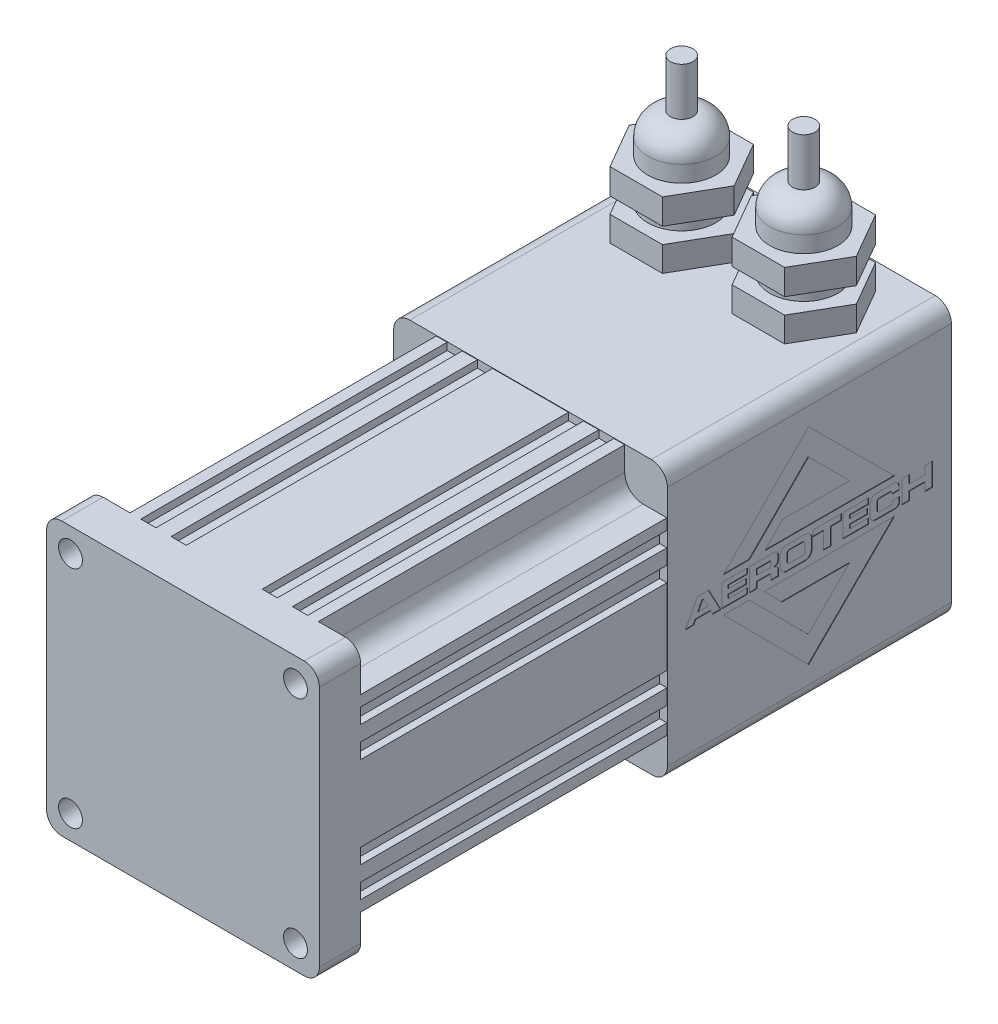
from build123d import *

# Parameters (mm, degrees)
SKETCH1_R                = 2.5
FRONT_MOUNT_PLATE_DEPTH  = 8.64
MOTOR_START              = 64.18
MOTOR_DEPTH              = 64.18
SKETCH3_W                = 3.175
SKETCH3_H                = 1.524
MOTOR_FINS_DEPTH         = 76.842822007
MOTOR_FINS_PATTERN_COUNT = 4
MOTOR_FINS_PATTERN_ANGLE = 270
ENC_CAN_DEPTH            = 59.51
LOGO_1_DEPTH             = 0.1
LOGO_2_DEPTH             = 0.1
SKETCH6_R                = 7.1247
EXTRUDE4_DEPTH           = 5.33
MIRROR3_COPY_1_SKETCH_R  = 7.1247
MIRROR3_COPY_1_DEPTH     = 5.33


with BuildPart() as part:
    # Sketch1 → Front Mount Plate (new body)
    with BuildSketch(Plane.XY):
        with BuildLine():
            Line((-25.4, 28.575), (25.4, 28.575))
            ThreePointArc((25.4, 28.575), (27.64506403, 27.64506403), (28.575, 25.4))
            Line((28.575, 25.4), (28.575, -25.4))
            ThreePointArc((28.575, -25.4), (27.64506403, -27.64506403), (25.4, -28.575))
            Line((25.4, -28.575), (-25.4, -28.575))
            ThreePointArc((-25.4, -28.575), (-27.64506403, -27.64506403), (-28.575, -25.4))
            Line((-28.575, -25.4), (-28.575, 25.4))
            ThreePointArc((-28.575, 25.4), (-27.64506403, 27.64506403), (-25.4, 28.575))
        make_face()
        with Locations((-23.5712, -23.5712)):
            Circle(SKETCH1_R, mode=Mode.SUBTRACT)
        with Locations((23.5712, -23.5712)):
            Circle(SKETCH1_R, mode=Mode.SUBTRACT)
        with Locations((23.5712, 23.5712)):
            Circle(SKETCH1_R, mode=Mode.SUBTRACT)
        with Locations((-23.5712, 23.5712)):
            Circle(SKETCH1_R, mode=Mode.SUBTRACT)
    extrude(amount=FRONT_MOUNT_PLATE_DEPTH)

    # Sketch2 → Motor (add)
    with BuildSketch(Plane(origin=(0, 0, 0), x_dir=(-1, 0, 0), z_dir=(0, 0, -1)).offset(MOTOR_START)):
        with BuildLine():
            Line((-28.575, -25.4), (-28.575, 25.4))
            ThreePointArc((-28.575, 25.4), (-27.64506403, 27.64506403), (-25.4, 28.575))
            Line((-25.4, 28.575), (25.4, 28.575))
            ThreePointArc((25.4, 28.575), (27.64506403, 27.64506403), (28.575, 25.4))
            Line((28.575, 25.4), (28.575, -25.4))
            ThreePointArc((28.575, -25.4), (27.64506403, -27.64506403), (25.4, -28.575))
            Line((25.4, -28.575), (-25.4, -28.575))
            ThreePointArc((-25.4, -28.575), (-27.64506403, -27.64506403), (-28.575, -25.4))
        make_face()
    extrude(amount=-MOTOR_DEPTH)

    # Sketch3 → Motor Fins (cut, through all)
    with BuildSketch(Plane.XY):
        with Locations((15.8877, 27.813)):
            Rectangle(SKETCH3_W, SKETCH3_H)
        with Locations((9.5377, 27.813)):
            Rectangle(SKETCH3_W, SKETCH3_H)
        with Locations((-9.5377, 27.813)):
            Rectangle(SKETCH3_W, SKETCH3_H)
        with Locations((-15.8877, 27.813)):
            Rectangle(SKETCH3_W, SKETCH3_H)
        with BuildLine():
            Line((-25.4, 28.575), (-19.7358, 28.575))
            Line((-19.7358, 28.575), (-19.7358, 23.5712))
            ThreePointArc((-19.7358, 23.5712), (-20.859162651, 20.859162651), (-23.5712, 19.7358))
            Line((-23.5712, 19.7358), (-28.575, 19.7358))
            Line((-28.575, 19.7358), (-28.575, 25.4))
            ThreePointArc((-28.575, 25.4), (-27.64506403, 27.64506403), (-25.4, 28.575))
        make_face()
    motor_fins = extrude(amount=-MOTOR_FINS_DEPTH, mode=Mode.SUBTRACT)

    # Motor Fins Pattern: Motor Fins ×4 about axis
    motor_fins_pattern_axis = Axis((0, 0, 0), (0, 0, 1))
    for i in range(1, MOTOR_FINS_PATTERN_COUNT):
        add(motor_fins.rotate(motor_fins_pattern_axis, i * MOTOR_FINS_PATTERN_ANGLE / (MOTOR_FINS_PATTERN_COUNT - 1)), mode=Mode.SUBTRACT)

    # Sketch4 → Enc Can (add)
    with BuildSketch(Plane(origin=(0, 0, -64.18), x_dir=(-1, 0, 0), z_dir=(0, 0, -1))):
        with BuildLine():
            Line((-25.3, 28.675), (25.3, 28.675))
            ThreePointArc((25.3, 28.675), (27.686485387, 27.686485387), (28.675, 25.3))
            Line((28.675, 25.3), (28.675, -25.3))
            ThreePointArc((28.675, -25.3), (27.74506403, -27.54506403), (25.5, -28.475))
            Line((25.5, -28.475), (-25.5, -28.475))
            ThreePointArc((-25.5, -28.475), (-27.74506403, -27.54506403), (-28.675, -25.3))
            Line((-28.675, -25.3), (-28.675, 25.3))
            ThreePointArc((-28.675, 25.3), (-27.686485387, 27.686485387), (-25.3, 28.675))
        make_face()
    extrude(amount=ENC_CAN_DEPTH)

    # Sketch11 → Logo-1 (cut)
    # profile 1 of 10: a face of its own
    with BuildSketch(Plane(origin=(28.675, 0, 0), x_dir=(0, 0, -1), z_dir=(1, 0, 0))):
        with BuildLine():
            Line((88.956539472, 2.316788931), (93.122148965, 2.316788931))
            ThreePointArc((93.122148965, 2.316788931), (94.084778657, 1.918054657), (94.483512931, 0.955424964))
            Line((94.483512931, 0.955424964), (94.483512931, -1.038605321))
            ThreePointArc((94.483512931, -1.038605321), (94.072113232, -2.031812054), (93.078906499, -2.443211754))
            Line((93.078906499, -2.443211754), (89.26866391, -2.443211754))
            ThreePointArc((89.26866391, -2.443211754), (88.232093749, -2.013850335), (87.80273233, -0.977280174))
            Line((87.80273233, -0.977280174), (87.80273233, 0.955374767))
            ThreePointArc((87.80273233, 0.955374767), (88.129983456, 1.84766388), (88.956539472, 2.316788931))
        make_face()
        with BuildLine():
            Line((91.079448669, 1.16369414), (92.556319474, 1.16369414))
            ThreePointArc((92.556319474, 1.16369414), (92.868638989, 1.03432716), (92.998005968, 0.722007645))
            Line((92.998005968, 0.722007645), (92.998005968, -0.809664847))
            ThreePointArc((92.998005968, -0.809664847), (92.870330318, -1.117901134), (92.562094031, -1.245576785))
            Line((92.562094031, -1.245576785), (89.822537295, -1.245576785))
            ThreePointArc((89.822537295, -1.245576785), (89.487816379, -1.106930841), (89.349170436, -0.772209925))
            Line((89.349170436, -0.772209925), (89.349170436, 0.730051524))
            ThreePointArc((89.349170436, 0.730051524), (89.479434311, 1.043185221), (89.79335656, 1.171537124))
            Line((89.79335656, 1.171537124), (91.079448669, 1.16369414))
        make_face(mode=Mode.SUBTRACT)
    # profile 2 of 10: a face of its own
    with BuildSketch(Plane(origin=(28.675, 0, 0), x_dir=(0, 0, -1), z_dir=(1, 0, 0))):
        with BuildLine():
            Line((81.415773981, 2.316788931), (86.520330974, 2.316788931))
            ThreePointArc((86.520330974, 2.316788931), (87.161521261, 2.051199218), (87.427110974, 1.410008931))
            Line((87.427110974, 1.410008931), (87.427110974, 0.449532912))
            ThreePointArc((87.427110974, 0.449532912), (87.188080233, -0.127538347), (86.611008974, -0.366569088))
            ThreePointArc((86.611008974, -0.366569088), (87.195561502, -0.613065085), (87.427110974, -1.203697608))
            Line((87.427110974, -1.203697608), (87.427110974, -2.443211754))
            Line((87.427110974, -2.443211754), (85.922951719, -2.443211754))
            Line((85.922951719, -2.443211754), (85.922951719, -1.610941242))
            ThreePointArc((85.922951719, -1.610941242), (85.803436348, -1.322405613), (85.514900719, -1.202890242))
            Line((85.514900719, -1.202890242), (82.908305074, -1.202890242))
            Line((82.908305074, -1.202890242), (82.908305074, -2.443211754))
            Line((82.908305074, -2.443211754), (81.415773981, -2.443211754))
            Line((81.415773981, -2.443211754), (81.415773981, 2.316788931))
        make_face()
        with BuildLine():
            Line((82.920844254, 1.1043745), (85.681564716, 1.1043745))
            ThreePointArc((85.681564716, 1.1043745), (85.859600205, 1.030629786), (85.93334492, 0.852594296))
            Line((85.93334492, 0.852594296), (85.93334492, 0.247958277))
            ThreePointArc((85.93334492, 0.247958277), (85.856876419, 0.063346984), (85.672265126, -0.013121517))
            Line((85.672265126, -0.013121517), (82.920844254, -0.013121517))
            Line((82.920844254, -0.013121517), (82.920844254, 1.1043745))
        make_face(mode=Mode.SUBTRACT)
    # profile 3 of 10: a face of its own
    with BuildSketch(Plane(origin=(28.675, 0, 0), x_dir=(0, 0, -1), z_dir=(1, 0, 0))):
        with BuildLine():
            Line((111.271781748, 0.540002839), (112.762701418, 0.540002839))
            Line((112.762701418, 0.540002839), (112.762701418, 1.29716236))
            ThreePointArc((112.762701418, 1.29716236), (112.46405971, 2.018147223), (111.743074848, 2.316788931))
            Line((111.743074848, 2.316788931), (107.935097855, 2.316788931))
            ThreePointArc((107.935097855, 2.316788931), (107.041111197, 1.946487532), (106.670809798, 1.052500874))
            Line((106.670809798, 1.052500874), (106.670809798, -1.212899467))
            ThreePointArc((106.670809798, -1.212899467), (107.031159924, -2.082861628), (107.901122085, -2.443211754))
            Line((107.901122085, -2.443211754), (111.977077253, -2.443211754))
            ThreePointArc((111.977077253, -2.443211754), (112.589594451, -2.189498823), (112.843307381, -1.576981626))
            Line((112.843307381, -1.576981626), (112.843307381, -0.678283909))
            Line((112.843307381, -0.678283909), (111.328083378, -0.678283909))
            Line((111.328083378, -0.678283909), (111.328083378, -0.951544488))
            ThreePointArc((111.328083378, -0.951544488), (111.205851055, -1.246639421), (110.910756121, -1.368871744))
            Line((110.910756121, -1.368871744), (108.715029091, -1.368871744))
            ThreePointArc((108.715029091, -1.368871744), (108.32779787, -1.208475321), (108.167401447, -0.8212441))
            Line((108.167401447, -0.8212441), (108.167401447, 0.569458663))
            ThreePointArc((108.167401447, 0.569458663), (108.322554592, 0.944031488), (108.697127417, 1.099184633))
            Line((108.697127417, 1.099184633), (110.869065584, 1.099184633))
            ThreePointArc((110.869065584, 1.099184633), (111.153828915, 0.981231799), (111.271781748, 0.696468469))
            Line((111.271781748, 0.696468469), (111.271781748, 0.540002839))
        make_face()
    # profile 4 of 10: a face of its own
    with BuildSketch(Plane(origin=(28.675, 0, 0), x_dir=(0, 0, -1), z_dir=(1, 0, 0))):
        Polygon((67.913442092, -2.443211754), (70.519013066, 2.316788931), (72.834564656, 2.316788931), (75.388256499, -2.443211754), (73.679022016, -2.443211754), (73.26113932, -1.625193216), (70.109738242, -1.625193216), (69.682429621, -2.443211754), align=None)
        Polygon((70.640555251, -0.532079818), (72.716251212, -0.532079818), (71.814742511, 1.170769951), (71.542063953, 1.170769951), align=None, mode=Mode.SUBTRACT)
    # profile 5 of 10: a face of its own
    with BuildSketch(Plane(origin=(28.675, 0, 0), x_dir=(0, 0, -1), z_dir=(1, 0, 0))):
        Polygon((75.591674731, 2.316788931), (80.922215973, 2.316788931), (80.922215973, 1.178037728), (77.010449966, 1.178037728), (77.010449966, 0.517293833), (80.719533796, 0.517293833), (80.719533796, -0.552868059), (77.010449966, -0.552868059), (77.010449966, -1.294684825), (80.922215973, -1.294684825), (80.922215973, -2.443211754), (75.591674731, -2.443211754), align=None)
    # profile 6 of 10: a face of its own
    with BuildSketch(Plane(origin=(28.675, 0, 0), x_dir=(0, 0, -1), z_dir=(1, 0, 0))):
        Polygon((94.745925163, 2.316788931), (100.655358626, 2.316788931), (100.655358626, 1.085160088), (98.455037655, 1.085160088), (98.455037655, -2.443211754), (96.87552153, -2.443211754), (96.87552153, 1.084354739), (94.745925163, 1.084354739), align=None)
    # profile 7 of 10: a face of its own
    with BuildSketch(Plane(origin=(28.675, 0, 0), x_dir=(0, 0, -1), z_dir=(1, 0, 0))):
        Polygon((100.945065473, 2.316788931), (106.30693418, 2.316788931), (106.30693418, 1.177009504), (102.419784622, 1.177009504), (102.419784622, 0.530208109), (106.116698476, 0.530208109), (106.116698476, -0.541453026), (102.419784622, -0.541453026), (102.419784622, -1.289189939), (106.30693418, -1.289189939), (106.30693418, -2.443211754), (100.945065473, -2.443211754), align=None)
    # profile 8 of 10: a face of its own
    with BuildSketch(Plane(origin=(28.675, 0, 0), x_dir=(0, 0, -1), z_dir=(1, 0, 0))):
        Polygon((113.34452477, 2.316788931), (114.89502028, 2.316788931), (114.89502028, 0.611709538), (118.170442044, 0.611709538), (118.170442044, 2.316788931), (119.759699942, 2.316788931), (119.759699942, -2.443211754), (118.170442044, -2.443211754), (118.170442044, -0.724745897), (114.89502028, -0.724745897), (114.89502028, -2.443211754), (113.34452477, -2.443211754), align=None)
    # profile 9 of 10: a face of its own
    with BuildSketch(Plane(origin=(28.675, 0, 0), x_dir=(0, 0, -1), z_dir=(1, 0, 0))):
        Polygon((75.928468902, -3.730818966), (81.378630854, -3.730818966), (93.677347723, -16.096217536), (102.326178126, -7.494026853), (88.199171591, -7.494026853), (84.472891266, -3.730818966), (111.777206828, -3.730818966), (93.755918219, -21.654925898), align=None)
    # profile 10 of 10: a face of its own
    with BuildSketch(Plane(origin=(28.675, 0, 0), x_dir=(0, 0, -1), z_dir=(1, 0, 0))):
        Polygon((75.928468902, 3.603816145), (93.755918219, 21.527923077), (111.777206828, 3.603816145), (84.602861623, 3.603816145), (88.263095225, 7.43129425), (102.390101759, 7.43129425), (93.741271357, 16.033484933), (81.378630854, 3.603816145), align=None)
    extrude(amount=-LOGO_1_DEPTH, mode=Mode.SUBTRACT)

    # Sketch12 → Logo-2 (cut)
    # profile 1 of 10: a face of its own
    with BuildSketch(Plane.ZY.offset(28.675)):
        with BuildLine():
            Line((-98.755309921, 2.316788931), (-94.589700428, 2.316788931))
            ThreePointArc((-94.589700428, 2.316788931), (-93.627070736, 1.918054657), (-93.228336461, 0.955424964))
            Line((-93.228336461, 0.955424964), (-93.228336461, -1.038605321))
            ThreePointArc((-93.228336461, -1.038605321), (-93.639736161, -2.031812054), (-94.632942894, -2.443211754))
            Line((-94.632942894, -2.443211754), (-98.443185483, -2.443211754))
            ThreePointArc((-98.443185483, -2.443211754), (-99.479755644, -2.013850335), (-99.909117063, -0.977280174))
            Line((-99.909117063, -0.977280174), (-99.909117063, 0.955374767))
            ThreePointArc((-99.909117063, 0.955374767), (-99.581865937, 1.84766388), (-98.755309921, 2.316788931))
        make_face()
        with BuildLine():
            Line((-96.632400724, 1.16369414), (-95.155529919, 1.16369414))
            ThreePointArc((-95.155529919, 1.16369414), (-94.843210403, 1.03432716), (-94.713843424, 0.722007645))
            Line((-94.713843424, 0.722007645), (-94.713843424, -0.809664847))
            ThreePointArc((-94.713843424, -0.809664847), (-94.841519075, -1.117901134), (-95.149755362, -1.245576785))
            Line((-95.149755362, -1.245576785), (-97.889312097, -1.245576785))
            ThreePointArc((-97.889312097, -1.245576785), (-98.224033014, -1.106930841), (-98.362678957, -0.772209925))
            Line((-98.362678957, -0.772209925), (-98.362678957, 0.730051524))
            ThreePointArc((-98.362678957, 0.730051524), (-98.232415081, 1.043185221), (-97.918492833, 1.171537124))
            Line((-97.918492833, 1.171537124), (-96.632400724, 1.16369414))
        make_face(mode=Mode.SUBTRACT)
    # profile 2 of 10: a face of its own
    with BuildSketch(Plane.ZY.offset(28.675)):
        with BuildLine():
            Line((-106.296075412, 2.316788931), (-101.191518418, 2.316788931))
            ThreePointArc((-101.191518418, 2.316788931), (-100.550328131, 2.051199218), (-100.284738418, 1.410008931))
            Line((-100.284738418, 1.410008931), (-100.284738418, 0.449532912))
            ThreePointArc((-100.284738418, 0.449532912), (-100.52376916, -0.127538347), (-101.100840418, -0.366569088))
            ThreePointArc((-101.100840418, -0.366569088), (-100.51628789, -0.613065085), (-100.284738418, -1.203697608))
            Line((-100.284738418, -1.203697608), (-100.284738418, -2.443211754))
            Line((-100.284738418, -2.443211754), (-101.788897674, -2.443211754))
            Line((-101.788897674, -2.443211754), (-101.788897674, -1.610941242))
            ThreePointArc((-101.788897674, -1.610941242), (-101.908413045, -1.322405613), (-102.196948674, -1.202890242))
            Line((-102.196948674, -1.202890242), (-104.803544318, -1.202890242))
            Line((-104.803544318, -1.202890242), (-104.803544318, -2.443211754))
            Line((-104.803544318, -2.443211754), (-106.296075412, -2.443211754))
            Line((-106.296075412, -2.443211754), (-106.296075412, 2.316788931))
        make_face()
        with BuildLine():
            Line((-104.791005139, 1.1043745), (-102.030284677, 1.1043745))
            ThreePointArc((-102.030284677, 1.1043745), (-101.852249187, 1.030629786), (-101.778504473, 0.852594296))
            Line((-101.778504473, 0.852594296), (-101.778504473, 0.247958277))
            ThreePointArc((-101.778504473, 0.247958277), (-101.854972974, 0.063346984), (-102.039584266, -0.013121517))
            Line((-102.039584266, -0.013121517), (-104.791005139, -0.013121517))
            Line((-104.791005139, -0.013121517), (-104.791005139, 1.1043745))
        make_face(mode=Mode.SUBTRACT)
    # profile 3 of 10: a face of its own
    with BuildSketch(Plane.ZY.offset(28.675)):
        with BuildLine():
            Line((-76.440067644, 0.540002839), (-74.949147975, 0.540002839))
            Line((-74.949147975, 0.540002839), (-74.949147975, 1.29716236))
            ThreePointArc((-74.949147975, 1.29716236), (-75.247789683, 2.018147223), (-75.968774545, 2.316788931))
            Line((-75.968774545, 2.316788931), (-79.776751537, 2.316788931))
            ThreePointArc((-79.776751537, 2.316788931), (-80.670738196, 1.946487532), (-81.041039595, 1.052500874))
            Line((-81.041039595, 1.052500874), (-81.041039595, -1.212899467))
            ThreePointArc((-81.041039595, -1.212899467), (-80.680689469, -2.082861628), (-79.810727308, -2.443211754))
            Line((-79.810727308, -2.443211754), (-75.734772139, -2.443211754))
            ThreePointArc((-75.734772139, -2.443211754), (-75.122254942, -2.189498823), (-74.868542012, -1.576981626))
            Line((-74.868542012, -1.576981626), (-74.868542012, -0.678283909))
            Line((-74.868542012, -0.678283909), (-76.383766015, -0.678283909))
            Line((-76.383766015, -0.678283909), (-76.383766015, -0.951544488))
            ThreePointArc((-76.383766015, -0.951544488), (-76.505998338, -1.246639421), (-76.801093271, -1.368871744))
            Line((-76.801093271, -1.368871744), (-78.996820302, -1.368871744))
            ThreePointArc((-78.996820302, -1.368871744), (-79.384051522, -1.208475321), (-79.544447946, -0.8212441))
            Line((-79.544447946, -0.8212441), (-79.544447946, 0.569458663))
            ThreePointArc((-79.544447946, 0.569458663), (-79.389294801, 0.944031488), (-79.014721976, 1.099184633))
            Line((-79.014721976, 1.099184633), (-76.842783808, 1.099184633))
            ThreePointArc((-76.842783808, 1.099184633), (-76.558020478, 0.981231799), (-76.440067644, 0.696468469))
            Line((-76.440067644, 0.696468469), (-76.440067644, 0.540002839))
        make_face()
    # profile 4 of 10: a face of its own
    with BuildSketch(Plane.ZY.offset(28.675)):
        Polygon((-119.798407301, -2.443211754), (-117.192836327, 2.316788931), (-114.877284737, 2.316788931), (-112.323592894, -2.443211754), (-114.032827377, -2.443211754), (-114.450710073, -1.625193216), (-117.602111151, -1.625193216), (-118.029419771, -2.443211754), align=None)
        Polygon((-117.071294142, -0.532079818), (-114.99559818, -0.532079818), (-115.897106882, 1.170769951), (-116.16978544, 1.170769951), align=None, mode=Mode.SUBTRACT)
    # profile 5 of 10: a face of its own
    with BuildSketch(Plane.ZY.offset(28.675)):
        Polygon((-112.120174662, 2.316788931), (-106.78963342, 2.316788931), (-106.78963342, 1.178037728), (-110.701399426, 1.178037728), (-110.701399426, 0.517293833), (-106.992315597, 0.517293833), (-106.992315597, -0.552868059), (-110.701399426, -0.552868059), (-110.701399426, -1.294684825), (-106.78963342, -1.294684825), (-106.78963342, -2.443211754), (-112.120174662, -2.443211754), align=None)
    # profile 6 of 10: a face of its own
    with BuildSketch(Plane.ZY.offset(28.675)):
        Polygon((-92.96592423, 2.316788931), (-87.056490767, 2.316788931), (-87.056490767, 1.085160088), (-89.256811737, 1.085160088), (-89.256811737, -2.443211754), (-90.836327862, -2.443211754), (-90.836327862, 1.084354739), (-92.96592423, 1.084354739), align=None)
    # profile 7 of 10: a face of its own
    with BuildSketch(Plane.ZY.offset(28.675)):
        Polygon((-86.76678392, 2.316788931), (-81.404915212, 2.316788931), (-81.404915212, 1.177009504), (-85.292064771, 1.177009504), (-85.292064771, 0.530208109), (-81.595150917, 0.530208109), (-81.595150917, -0.541453026), (-85.292064771, -0.541453026), (-85.292064771, -1.289189939), (-81.404915212, -1.289189939), (-81.404915212, -2.443211754), (-86.76678392, -2.443211754), align=None)
    # profile 8 of 10: a face of its own
    with BuildSketch(Plane.ZY.offset(28.675)):
        Polygon((-74.367324622, 2.316788931), (-72.816829113, 2.316788931), (-72.816829113, 0.611709538), (-69.541407348, 0.611709538), (-69.541407348, 2.316788931), (-67.952149451, 2.316788931), (-67.952149451, -2.443211754), (-69.541407348, -2.443211754), (-69.541407348, -0.724745897), (-72.816829113, -0.724745897), (-72.816829113, -2.443211754), (-74.367324622, -2.443211754), align=None)
    # profile 9 of 10: a face of its own
    with BuildSketch(Plane.ZY.offset(28.675)):
        Polygon((-111.783380491, -3.730818966), (-106.333218539, -3.730818966), (-94.034501669, -16.096217536), (-85.385671267, -7.494026853), (-99.512677801, -7.494026853), (-103.238958127, -3.730818966), (-75.934642565, -3.730818966), (-93.955931174, -21.654925898), align=None)
    # profile 10 of 10: a face of its own
    with BuildSketch(Plane.ZY.offset(28.675)):
        Polygon((-111.783380491, 3.603816145), (-93.955931174, 21.527923077), (-75.934642565, 3.603816145), (-103.10898777, 3.603816145), (-99.448754168, 7.43129425), (-85.321747633, 7.43129425), (-93.970578036, 16.033484933), (-106.333218539, 3.603816145), align=None)
    extrude(amount=-LOGO_2_DEPTH, mode=Mode.SUBTRACT)

    # Sketch5 → Revolve1 (revolve)
    with BuildSketch(Plane.XY.offset(-108.65), mode=Mode.PRIVATE) as revolve1_sk:
        with BuildLine():
            Line((-19.9197, 45.9978), (-19.9197, 28.675))
            Line((-19.9197, 28.675), (-12.795, 28.675))
            Line((-12.795, 28.675), (-12.795, 60.773))
            Line((-12.795, 60.773), (-15.1445, 60.773))
            Line((-15.1445, 60.773), (-15.1445, 50.773))
            ThreePointArc((-15.1445, 50.773), (-18.521076302, 49.374376302), (-19.9197, 45.9978))
        make_face()
    revolve1 = revolve(revolve1_sk.sketch.rotate(Axis((-12.795, 22.892602075, -108.65), (0, 1, 0)), 270), axis=Axis((-12.795, 22.892602075, -108.65), (0, 1, 0)))

    # Sketch6 → Extrude4 (add)
    with BuildSketch(Plane(origin=(0, 28.575, 0), x_dir=(-1, 0, 0), z_dir=(0, 1, 0))):
        Polygon((7.295, -118.176279442), (18.295, -118.176279442), (23.795, -108.65), (18.295, -99.123720558), (7.295, -99.123720558), (1.795, -108.65), align=None)
        with Locations(Location((12.795, -108.65, 0), (0, 0, 270))):
            Circle(SKETCH6_R, mode=Mode.SUBTRACT)
    extrude4 = extrude(amount=EXTRUDE4_DEPTH)

    # Mirror2: Extrude4 across plane
    add(extrude4.mirror(Plane.ZX.offset(35.57)))

    # Mirror3: Revolve1, Extrude4 across plane
    add(revolve1.mirror(Plane(origin=(0, 0, 0), x_dir=(0, 0, 1), z_dir=(1, 0, 0))))
    add(extrude4.mirror(Plane(origin=(0, 0, 0), x_dir=(0, 0, 1), z_dir=(1, 0, 0))))

    # Mirror3 copy 1 sketch → Mirror3 copy 1 (add)
    with BuildSketch(Plane.XZ.offset(-42.565)):
        Polygon((7.295, -118.176279442), (18.295, -118.176279442), (23.795, -108.65), (18.295, -99.123720558), (7.295, -99.123720558), (1.795, -108.65), align=None)
        with Locations(Location((12.795, -108.65, 0), (0, 0, 270))):
            Circle(MIRROR3_COPY_1_SKETCH_R, mode=Mode.SUBTRACT)
    extrude(amount=MIRROR3_COPY_1_DEPTH)


solid = part.part
